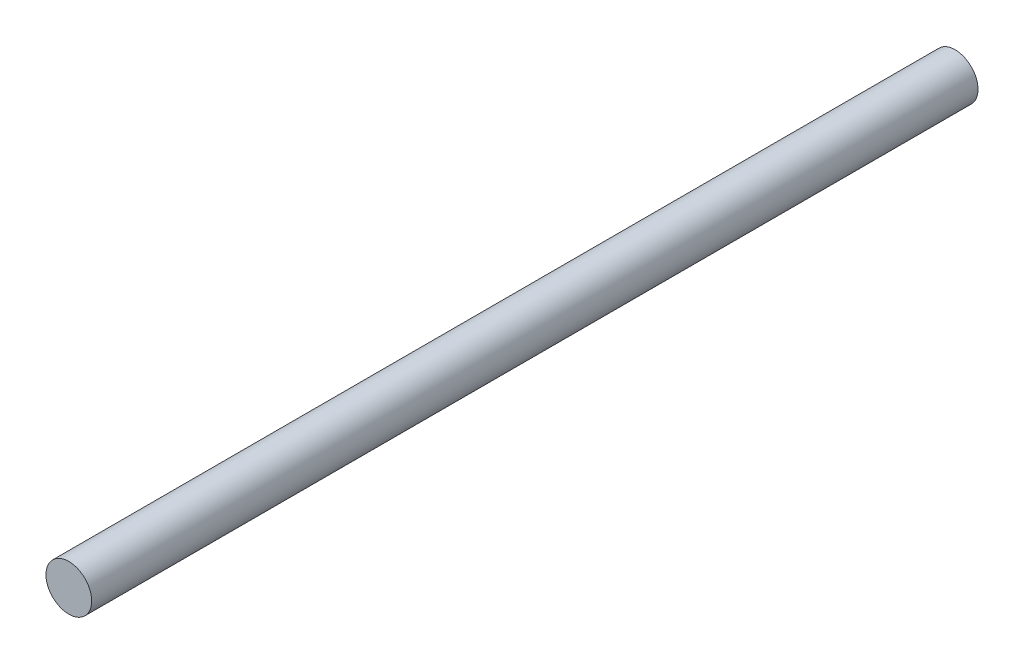
from build123d import *

# Parameters (mm, degrees)
SKETCH1_R           = 3.95
BOSS_EXTRUDE1_DEPTH = 153.15


with BuildPart() as part:
    # Sketch1 → Boss-Extrude1 (new body)
    with BuildSketch(Plane.XY):
        Circle(SKETCH1_R)
    extrude(amount=BOSS_EXTRUDE1_DEPTH)


solid = part.part
